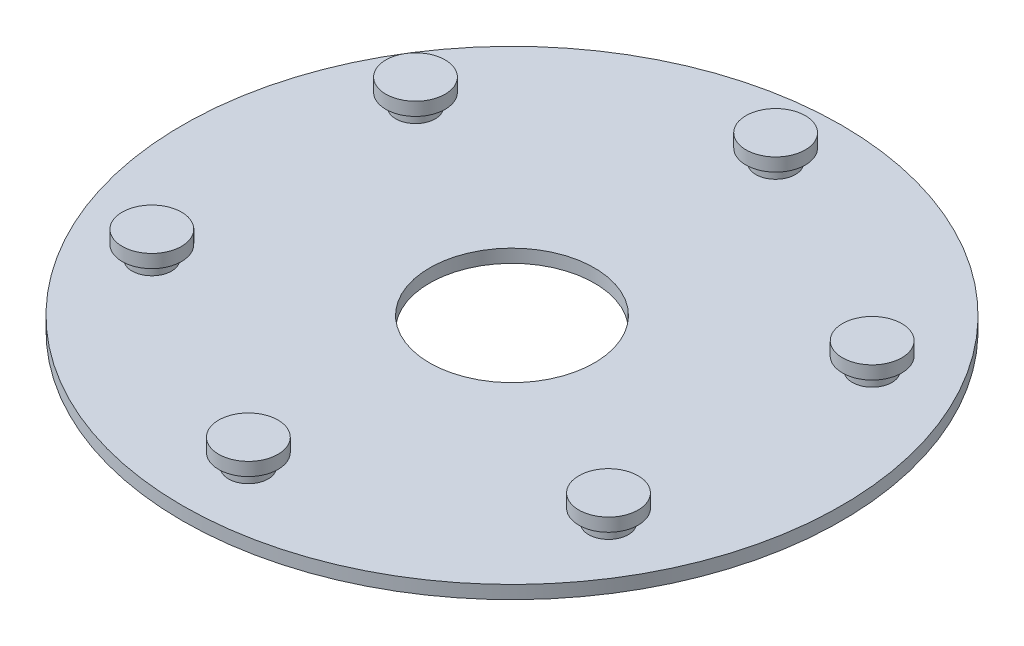
from build123d import *

# Parameters (mm, degrees)
SKETCH1_R           = 50
BOSS_EXTRUDE1_DEPTH = 2
SKETCH2_R           = 12.5
CUT_EXTRUDE1_DEPTH  = 2
SKETCH2_3_R         = 4.5
BOSS_EXTRUDE2_DEPTH = 4
SKETCH2_4_R         = 4.5
SKETCH2_4_R_2       = 3
CUT_EXTRUDE2_DEPTH  = 2
CIRPATTERN1_COUNT   = 12


with BuildPart() as part:
    # Sketch1 → Boss-Extrude1 (new body)
    with BuildSketch(Plane(origin=(0, 0, 0), x_dir=(1, 0, 0), z_dir=(0, 1, 0))):
        with Locations(Location((0, 0, 0), (0, 0, 270))):
            Circle(SKETCH1_R)
    extrude(amount=BOSS_EXTRUDE1_DEPTH)

    # Sketch2 → Cut-Extrude1 (cut)
    with BuildSketch(Plane(origin=(0, 2, 0), x_dir=(1, 0, 0), z_dir=(0, 1, 0))):
        with Locations(Location((0, 0, 0), (0, 0, 270))):
            Circle(SKETCH2_R)
    extrude(amount=-CUT_EXTRUDE1_DEPTH, mode=Mode.SUBTRACT)

    # Sketch2<3> → Boss-Extrude2 (add)
    with BuildSketch(Plane(origin=(0, 2, 0), x_dir=(1, 0, 0), z_dir=(0, 1, 0))):
        with Locations(Location((0, -40, 0), (0, 0, 270))):
            Circle(SKETCH2_3_R)
    boss_extrude2 = extrude(amount=BOSS_EXTRUDE2_DEPTH)

    # Sketch2<4> → Cut-Extrude2 (cut)
    with BuildSketch(Plane(origin=(0, 2, 0), x_dir=(1, 0, 0), z_dir=(0, 1, 0))):
        with Locations(Location((0, -40, 0), (0, 0, 270))):
            Circle(SKETCH2_4_R)
        with Locations(Location((0, -40, 0), (0, 0, 270))):
            Circle(SKETCH2_4_R_2, mode=Mode.SUBTRACT)
    cut_extrude2 = extrude(amount=CUT_EXTRUDE2_DEPTH, mode=Mode.SUBTRACT)

    # CirPattern1: Boss-Extrude2, Cut-Extrude2 ×12 about axis, 6 skipped
    cirpattern1_axis = Axis((0, -35.355339059, 0), (0, 1, 0))
    add([boss_extrude2.rotate(cirpattern1_axis, i * 360 / CIRPATTERN1_COUNT) for i in range(1, CIRPATTERN1_COUNT) if i not in (1, 3, 5, 7, 9, 11)])
    add([cut_extrude2.rotate(cirpattern1_axis, i * 360 / CIRPATTERN1_COUNT) for i in range(1, CIRPATTERN1_COUNT) if i not in (1, 3, 5, 7, 9, 11)], mode=Mode.SUBTRACT)


solid = part.part
